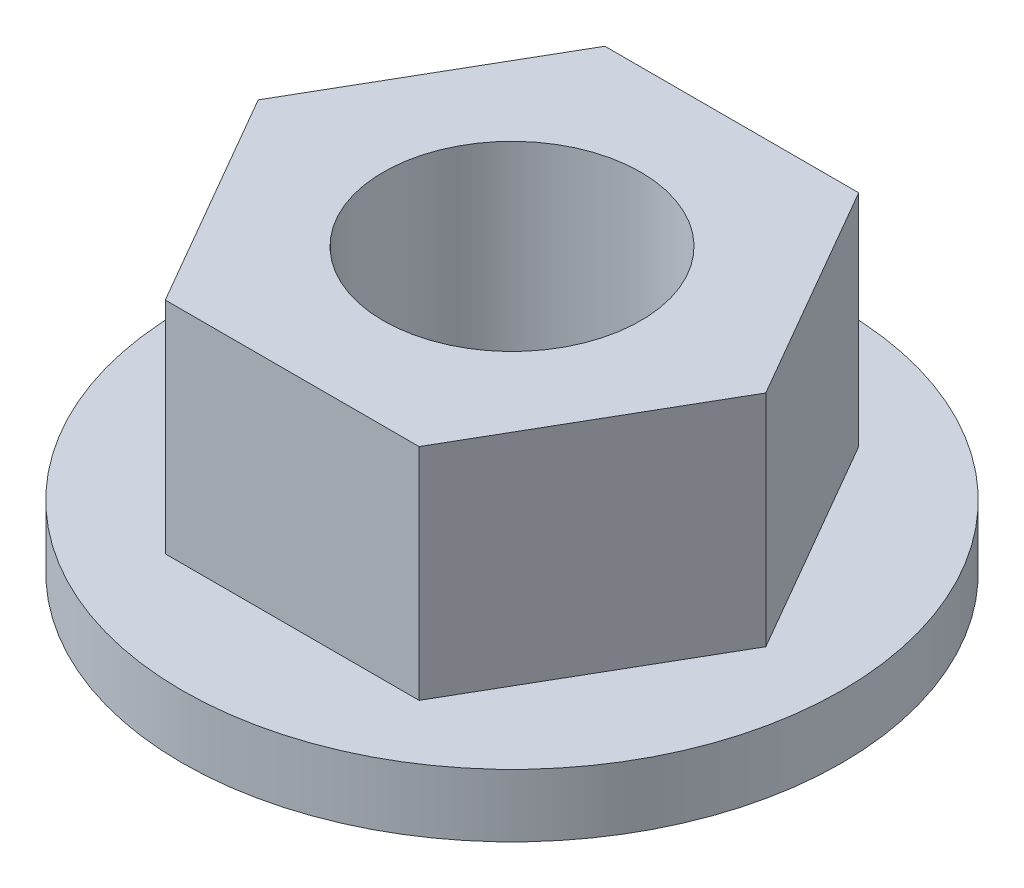
from build123d import *

# Parameters (mm, degrees)
HEX_NUT_DEPTH                     = 3.5
NUT_FLANGE_SKETCH_R               = 5.25
NUT_FLANGE_DEPTH                  = 1
M4_INTERNAL_THREAD_BLANK_SKETCH_R = 2.05
M4_INTERNAL_THREAD_BLANK_DEPTH    = 4.7


with BuildPart() as part:
    # Hex Nut Sketch → Hex Nut (new body)
    with BuildSketch(Plane(origin=(0, 138.5, 0), x_dir=(1, 0, 0), z_dir=(0, 1, 0))):
        Polygon((-16.250199362, 0), (-18.270925304, -3.5), (-22.312377188, -3.5), (-24.33310313, 0), (-22.312377188, 3.5), (-18.270925304, 3.5), align=None)
    extrude(amount=-HEX_NUT_DEPTH)

    # Nut Flange Sketch → Nut Flange (add)
    with BuildSketch(Plane(origin=(0, 135, 0), x_dir=(1, 0, 0), z_dir=(0, 1, 0))):
        with Locations(Location((-20.291651246, 0, 0), (0, 0, 270))):
            Circle(NUT_FLANGE_SKETCH_R)
    extrude(amount=-NUT_FLANGE_DEPTH)

    # M4 Internal Thread Blank Sketch → M4 Internal Thread Blank (cut)
    with BuildSketch(Plane(origin=(0, 138.6, 0), x_dir=(1, 0, 0), z_dir=(0, 1, 0))):
        with Locations(Location((-20.291651246, 0, 0), (0, 0, 270))):
            Circle(M4_INTERNAL_THREAD_BLANK_SKETCH_R)
    extrude(amount=-M4_INTERNAL_THREAD_BLANK_DEPTH, mode=Mode.SUBTRACT)


solid = part.part
